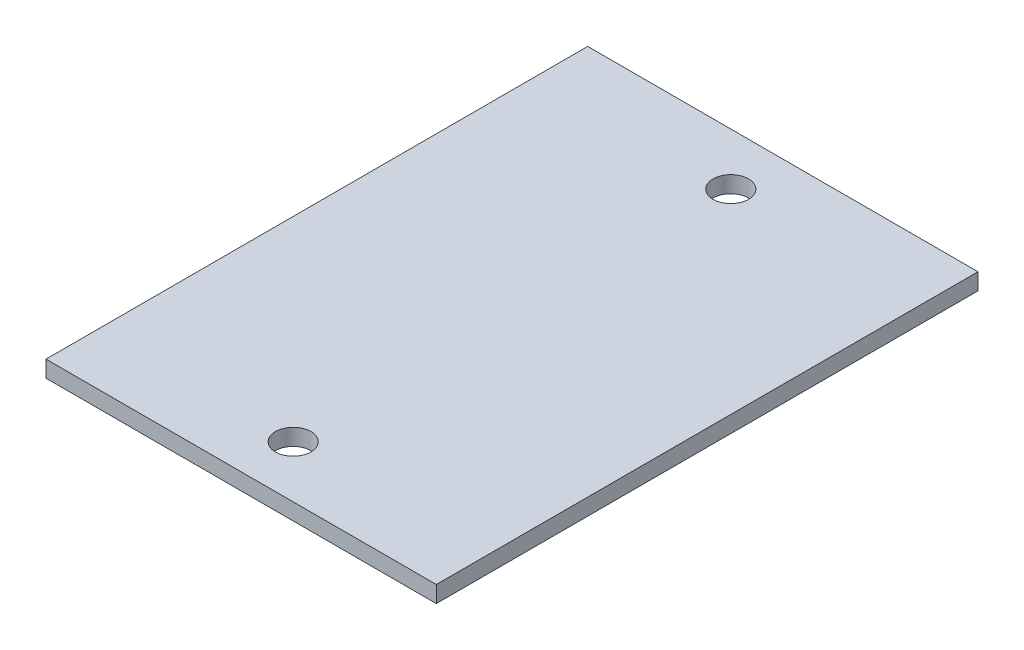
from build123d import *

# Parameters (mm, degrees)
SKETCH1_W           = 33
SKETCH1_H           = 45.8
SKETCH1_R           = 1.5
BOSS_EXTRUDE1_DEPTH = 1.4


with BuildPart() as part:
    # Sketch1 → Boss-Extrude1 (new body)
    with BuildSketch(Plane(origin=(0, 0, 0), x_dir=(1, 0, 0), z_dir=(0, 1, 0))):
        Rectangle(SKETCH1_W, SKETCH1_H)
        with Locations(Location((0, 18.5, 0), (0, 0, 270))):
            Circle(SKETCH1_R, mode=Mode.SUBTRACT)
        with Locations(Location((0, -18.5, 0), (0, 0, 270))):
            Circle(SKETCH1_R, mode=Mode.SUBTRACT)
    extrude(amount=BOSS_EXTRUDE1_DEPTH)


solid = part.part
